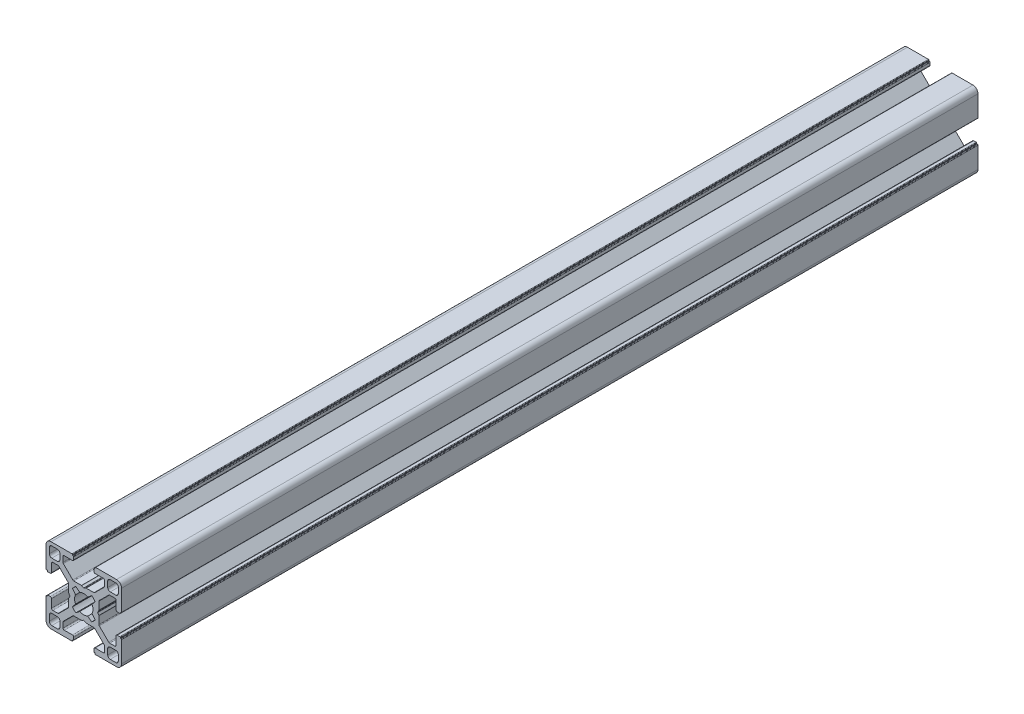
from build123d import *

# Parameters (mm, degrees)
SALIENTE_EXTRUIR1_DEPTH = 1000
CORTAR_EXTRUIR1_START   = -660
CORTAR_EXTRUIR1_DEPTH   = 660


with BuildPart() as part:
    # Croquis1 → Saliente-Extruir1 (new body)
    with BuildSketch(Plane.XY.offset(1000)):
        with BuildLine():
            Line((9.800000436, -10.500000436), (10.100000436, -10.500000436))
            ThreePointArc((10.100000436, -10.500000436), (10.241421792, -10.441421792), (10.300000436, -10.300000436))
            Line((10.300000436, -10.300000436), (10.300000436, -2))
            ThreePointArc((10.300000436, -2), (9.714213998, -0.585786438), (8.300000436, 0))
            Line((8.300000436, 0), (0, 0))
            ThreePointArc((0, 0), (-0.141421356, -0.058578644), (-0.2, -0.2))
            Line((-0.2, -0.2), (-0.2, -0.5))
            Line((-0.2, -0.5), (-0.49999919, -0.5))
            ThreePointArc((-0.49999919, -0.5), (-0.641420811, -0.558578753), (-0.699999564, -0.700000374))
            Line((-0.699999564, -0.700000374), (-0.699999564, -1.700000763))
            ThreePointArc((-0.699999564, -1.700000763), (-0.553552955, -2.053554154), (-0.199999564, -2.200000763))
            Line((-0.199999564, -2.200000763), (3.050000763, -2.200000763))
            ThreePointArc((3.050000763, -2.200000763), (3.403554154, -2.346447372), (3.550000763, -2.700000763))
            Line((3.550000763, -2.700000763), (3.550000763, -4.743055509))
            ThreePointArc((3.550000763, -4.743055509), (3.511993279, -4.934269826), (3.403749103, -5.096413843))
            Line((3.403749103, -5.096413843), (-0.349053376, -8.853358334))
            ThreePointArc((-0.349053376, -8.853358334), (-0.511332616, -8.961886981), (-0.702801716, -9))
            Line((-0.702801716, -9), (-3.746809419, -9))
            ThreePointArc((-3.746809419, -9), (-3.798212795, -9.006718618), (-3.846162576, -9.026423071))
            Line((-3.846162576, -9.026423071), (-4.600646407, -9.458279719))
            ThreePointArc((-4.600646407, -9.458279719), (-4.699999564, -9.48470279), (-4.799352721, -9.458279719))
            Line((-4.799352721, -9.458279719), (-5.553836552, -9.026423071))
            ThreePointArc((-5.553836552, -9.026423071), (-5.601786333, -9.006718618), (-5.653189709, -9))
            Line((-5.653189709, -9), (-8.697197412, -9))
            ThreePointArc((-8.697197412, -9), (-8.888666513, -8.961886981), (-9.050945752, -8.853358334))
            Line((-9.050945752, -8.853358334), (-12.803748231, -5.096413843))
            ThreePointArc((-12.803748231, -5.096413843), (-12.911992407, -4.934269826), (-12.949999891, -4.743055509))
            Line((-12.949999891, -4.743055509), (-12.949999891, -2.700000763))
            ThreePointArc((-12.949999891, -2.700000763), (-12.803553282, -2.346447372), (-12.449999891, -2.200000763))
            Line((-12.449999891, -2.200000763), (-9.199999564, -2.200000763))
            ThreePointArc((-9.199999564, -2.200000763), (-8.846446173, -2.053554154), (-8.699999564, -1.700000763))
            Line((-8.699999564, -1.700000763), (-8.699999564, -0.700000374))
            ThreePointArc((-8.699999564, -0.700000374), (-8.758578317, -0.558578753), (-8.899999938, -0.5))
            Line((-8.899999938, -0.5), (-9.199999128, -0.5))
            Line((-9.199999128, -0.5), (-9.199999128, -0.2))
            ThreePointArc((-9.199999128, -0.2), (-9.258577772, -0.058578644), (-9.399999128, 0))
            Line((-9.399999128, 0), (-17.699999564, 0))
            ThreePointArc((-17.699999564, 0), (-19.114213126, -0.585786438), (-19.699999564, -2))
            Line((-19.699999564, -2), (-19.699999564, -10.300000436))
            ThreePointArc((-19.699999564, -10.300000436), (-19.64142092, -10.441421792), (-19.499999564, -10.500000436))
            Line((-19.499999564, -10.500000436), (-19.199999564, -10.500000436))
            Line((-19.199999564, -10.500000436), (-19.199999564, -10.799999627))
            ThreePointArc((-19.199999564, -10.799999627), (-19.141420811, -10.941421247), (-18.99999919, -11))
            Line((-18.99999919, -11), (-17.999998801, -11))
            ThreePointArc((-17.999998801, -11), (-17.64644541, -10.853553391), (-17.499998801, -10.5))
            Line((-17.499998801, -10.5), (-17.499998801, -7.249999673))
            ThreePointArc((-17.499998801, -7.249999673), (-17.353552192, -6.896446283), (-16.999998801, -6.749999673))
            Line((-16.999998801, -6.749999673), (-14.956944055, -6.749999673))
            ThreePointArc((-14.956944055, -6.749999673), (-14.765729738, -6.788007157), (-14.603585721, -6.896251334))
            Line((-14.603585721, -6.896251334), (-10.84664123, -10.649053813))
            ThreePointArc((-10.84664123, -10.649053813), (-10.738112583, -10.811333052), (-10.699999564, -11.002802152))
            Line((-10.699999564, -11.002802152), (-10.699999564, -14.046809855))
            ThreePointArc((-10.699999564, -14.046809855), (-10.693280947, -14.098213232), (-10.673576493, -14.146163012))
            Line((-10.673576493, -14.146163012), (-10.241719845, -14.900646843))
            ThreePointArc((-10.241719845, -14.900646843), (-10.215296774, -15), (-10.241719845, -15.099353157))
            Line((-10.241719845, -15.099353157), (-10.673576493, -15.853836988))
            ThreePointArc((-10.673576493, -15.853836988), (-10.693280947, -15.901786769), (-10.699999564, -15.953190146))
            Line((-10.699999564, -15.953190146), (-10.699999564, -18.997197848))
            ThreePointArc((-10.699999564, -18.997197848), (-10.738112583, -19.188666949), (-10.84664123, -19.350946188))
            Line((-10.84664123, -19.350946188), (-14.603585721, -23.103748667))
            ThreePointArc((-14.603585721, -23.103748667), (-14.765729738, -23.211992843), (-14.956944055, -23.250000327))
            Line((-14.956944055, -23.250000327), (-16.999998801, -23.250000327))
            ThreePointArc((-16.999998801, -23.250000327), (-17.353552192, -23.103553718), (-17.499998801, -22.750000327))
            Line((-17.499998801, -22.750000327), (-17.499998801, -19.5))
            ThreePointArc((-17.499998801, -19.5), (-17.64644541, -19.14644661), (-17.999998801, -19))
            Line((-17.999998801, -19), (-18.99999919, -19))
            ThreePointArc((-18.99999919, -19), (-19.141420811, -19.058578753), (-19.199999564, -19.200000374))
            Line((-19.199999564, -19.200000374), (-19.199999564, -19.499999564))
            Line((-19.199999564, -19.499999564), (-19.499999564, -19.499999564))
            ThreePointArc((-19.499999564, -19.499999564), (-19.64142092, -19.558578208), (-19.699999564, -19.699999564))
            Line((-19.699999564, -19.699999564), (-19.699999564, -28))
            ThreePointArc((-19.699999564, -28), (-19.114213126, -29.414213563), (-17.699999564, -30))
            Line((-17.699999564, -30), (-9.399999128, -30))
            ThreePointArc((-9.399999128, -30), (-9.258577772, -29.941421356), (-9.199999128, -29.8))
            Line((-9.199999128, -29.8), (-9.199999128, -29.5))
            Line((-9.199999128, -29.5), (-8.899999938, -29.5))
            ThreePointArc((-8.899999938, -29.5), (-8.758578317, -29.441421247), (-8.699999564, -29.299999627))
            Line((-8.699999564, -29.299999627), (-8.699999564, -28.299999237))
            ThreePointArc((-8.699999564, -28.299999237), (-8.846446173, -27.946445847), (-9.199999564, -27.799999237))
            Line((-9.199999564, -27.799999237), (-12.449999891, -27.799999237))
            ThreePointArc((-12.449999891, -27.799999237), (-12.803553282, -27.653552628), (-12.949999891, -27.299999237))
            Line((-12.949999891, -27.299999237), (-12.949999891, -25.256944491))
            ThreePointArc((-12.949999891, -25.256944491), (-12.911992407, -25.065730174), (-12.803748231, -24.903586157))
            Line((-12.803748231, -24.903586157), (-9.050945752, -21.146641666))
            ThreePointArc((-9.050945752, -21.146641666), (-8.888666513, -21.038113019), (-8.697197412, -21))
            Line((-8.697197412, -21), (-5.653189709, -21))
            ThreePointArc((-5.653189709, -21), (-5.601786333, -20.993281383), (-5.553836552, -20.973576929))
            Line((-5.553836552, -20.973576929), (-4.799352721, -20.541720281))
            ThreePointArc((-4.799352721, -20.541720281), (-4.699999564, -20.51529721), (-4.600646407, -20.541720281))
            Line((-4.600646407, -20.541720281), (-3.846162576, -20.973576929))
            ThreePointArc((-3.846162576, -20.973576929), (-3.798212795, -20.993281383), (-3.746809419, -21))
            Line((-3.746809419, -21), (-0.702801716, -21))
            ThreePointArc((-0.702801716, -21), (-0.511332616, -21.038113019), (-0.349053377, -21.146641666))
            Line((-0.349053377, -21.146641666), (3.403749103, -24.903586157))
            ThreePointArc((3.403749103, -24.903586157), (3.511993279, -25.065730174), (3.550000763, -25.256944491))
            Line((3.550000763, -25.256944491), (3.550000763, -27.299999237))
            ThreePointArc((3.550000763, -27.299999237), (3.403554154, -27.653552628), (3.050000763, -27.799999237))
            Line((3.050000763, -27.799999237), (-0.199999564, -27.799999237))
            ThreePointArc((-0.199999564, -27.799999237), (-0.553552955, -27.946445847), (-0.699999564, -28.299999237))
            Line((-0.699999564, -28.299999237), (-0.699999564, -29.299999627))
            ThreePointArc((-0.699999564, -29.299999627), (-0.641420811, -29.441421247), (-0.49999919, -29.5))
            Line((-0.49999919, -29.5), (-0.2, -29.5))
            Line((-0.2, -29.5), (-0.2, -29.8))
            ThreePointArc((-0.2, -29.8), (-0.141421356, -29.941421356), (0, -30))
            Line((0, -30), (8.300000436, -30))
            ThreePointArc((8.300000436, -30), (9.714213998, -29.414213563), (10.300000436, -28))
            Line((10.300000436, -28), (10.300000436, -19.699999564))
            ThreePointArc((10.300000436, -19.699999564), (10.241421792, -19.558578208), (10.100000436, -19.499999564))
            Line((10.100000436, -19.499999564), (9.800000436, -19.499999564))
            Line((9.800000436, -19.499999564), (9.800000436, -19.200000374))
            ThreePointArc((9.800000436, -19.200000374), (9.741421683, -19.058578753), (9.600000062, -19))
            Line((9.600000062, -19), (8.599999673, -19))
            ThreePointArc((8.599999673, -19), (8.246446283, -19.14644661), (8.099999673, -19.5))
            Line((8.099999673, -19.5), (8.099999673, -22.750000327))
            ThreePointArc((8.099999673, -22.750000327), (7.953553064, -23.103553718), (7.599999673, -23.250000327))
            Line((7.599999673, -23.250000327), (5.556944927, -23.250000327))
            ThreePointArc((5.556944927, -23.250000327), (5.36573061, -23.211992843), (5.203586593, -23.103748667))
            Line((5.203586593, -23.103748667), (1.446642102, -19.350946188))
            ThreePointArc((1.446642102, -19.350946188), (1.338113455, -19.188666949), (1.300000436, -18.997197848))
            Line((1.300000436, -18.997197848), (1.300000436, -15.953190145))
            ThreePointArc((1.300000436, -15.953190145), (1.293281819, -15.901786769), (1.273577365, -15.853836988))
            Line((1.273577365, -15.853836988), (0.841720717, -15.099353157))
            ThreePointArc((0.841720717, -15.099353157), (0.815297646, -15), (0.841720717, -14.900646843))
            Line((0.841720717, -14.900646843), (1.273577365, -14.146163012))
            ThreePointArc((1.273577365, -14.146163012), (1.293281819, -14.098213231), (1.300000436, -14.046809855))
            Line((1.300000436, -14.046809855), (1.300000436, -11.002802152))
            ThreePointArc((1.300000436, -11.002802152), (1.338113455, -10.811333051), (1.446642102, -10.649053812))
            Line((1.446642102, -10.649053812), (5.203586593, -6.896251334))
            ThreePointArc((5.203586593, -6.896251334), (5.36573061, -6.788007157), (5.556944927, -6.749999673))
            Line((5.556944927, -6.749999673), (7.599999673, -6.749999673))
            ThreePointArc((7.599999673, -6.749999673), (7.953553064, -6.896446283), (8.099999673, -7.249999673))
            Line((8.099999673, -7.249999673), (8.099999673, -10.5))
            ThreePointArc((8.099999673, -10.5), (8.246446283, -10.853553391), (8.599999673, -11))
            Line((8.599999673, -11), (9.600000062, -11))
            ThreePointArc((9.600000062, -11), (9.741421683, -10.941421247), (9.800000436, -10.799999627))
            Line((9.800000436, -10.799999627), (9.800000436, -10.500000436))
        make_face()
        with BuildLine():
            Line((8.000001536, -5.500000365), (5.800000754, -5.500000365))
            ThreePointArc((5.800000754, -5.500000365), (5.092893979, -5.207107149), (4.800000763, -4.500000374))
            Line((4.800000763, -4.500000374), (4.800000763, -2.299999592))
            ThreePointArc((4.800000763, -2.299999592), (5.092893979, -1.592892818), (5.800000754, -1.299999602))
            Line((5.800000754, -1.299999602), (8.000001536, -1.299999602))
            ThreePointArc((8.000001536, -1.299999602), (8.70710831, -1.592892818), (9.000001526, -2.299999592))
            Line((9.000001526, -2.299999592), (9.000001526, -4.500000374))
            ThreePointArc((9.000001526, -4.500000374), (8.70710831, -5.207107149), (8.000001536, -5.500000365))
        make_face(mode=Mode.SUBTRACT)
        with BuildLine():
            Line((-15.199999881, -5.500000365), (-17.400000663, -5.500000365))
            ThreePointArc((-17.400000663, -5.500000365), (-18.107107438, -5.207107149), (-18.400000654, -4.500000374))
            Line((-18.400000654, -4.500000374), (-18.400000654, -2.299999592))
            ThreePointArc((-18.400000654, -2.299999592), (-18.107107438, -1.592892818), (-17.400000664, -1.299999602))
            Line((-17.400000664, -1.299999602), (-15.199999881, -1.299999602))
            ThreePointArc((-15.199999881, -1.299999602), (-14.492893107, -1.592892818), (-14.199999891, -2.299999592))
            Line((-14.199999891, -2.299999592), (-14.199999891, -4.500000374))
            ThreePointArc((-14.199999891, -4.500000374), (-14.492893107, -5.207107149), (-15.199999881, -5.500000365))
        make_face(mode=Mode.SUBTRACT)
        with BuildLine():
            Line((-17.400000664, -24.499999636), (-15.199999881, -24.499999636))
            ThreePointArc((-15.199999881, -24.499999636), (-14.492893107, -24.792892852), (-14.199999891, -25.499999626))
            Line((-14.199999891, -25.499999626), (-14.199999891, -27.700000408))
            ThreePointArc((-14.199999891, -27.700000408), (-14.492893107, -28.407107183), (-15.199999881, -28.700000399))
            Line((-15.199999881, -28.700000399), (-17.400000663, -28.700000399))
            ThreePointArc((-17.400000663, -28.700000399), (-18.107107438, -28.407107183), (-18.400000654, -27.700000408))
            Line((-18.400000654, -27.700000408), (-18.400000654, -25.499999626))
            ThreePointArc((-18.400000654, -25.499999626), (-18.107107438, -24.792892852), (-17.400000664, -24.499999636))
        make_face(mode=Mode.SUBTRACT)
        with BuildLine():
            Line((5.800000754, -24.499999636), (8.000001536, -24.499999636))
            ThreePointArc((8.000001536, -24.499999636), (8.70710831, -24.792892852), (9.000001526, -25.499999626))
            Line((9.000001526, -25.499999626), (9.000001526, -27.700000408))
            ThreePointArc((9.000001526, -27.700000408), (8.70710831, -28.407107183), (8.000001536, -28.700000399))
            Line((8.000001536, -28.700000399), (5.800000754, -28.700000399))
            ThreePointArc((5.800000754, -28.700000399), (5.092893979, -28.407107183), (4.800000763, -27.700000408))
            Line((4.800000763, -27.700000408), (4.800000763, -25.499999626))
            ThreePointArc((4.800000763, -25.499999626), (5.092893979, -24.792892852), (5.800000754, -24.499999636))
        make_face(mode=Mode.SUBTRACT)
        with BuildLine():
            Line((-7.835928976, -10.481599097), (-6.300129088, -11.719438233))
            ThreePointArc((-6.300129088, -11.719438233), (-4.699999564, -11.35), (-3.09987004, -11.719438233))
            Line((-3.09987004, -11.719438233), (-1.564070152, -10.481599097))
            ThreePointArc((-1.564070152, -10.481599097), (-0.818997305, -11.10284444), (-0.194662672, -11.845330527))
            Line((-0.194662672, -11.845330527), (-1.419437832, -13.399870404))
            ThreePointArc((-1.419437832, -13.399870404), (-1.049999564, -15), (-1.419437832, -16.600129597))
            Line((-1.419437832, -16.600129597), (-0.194662672, -18.154669473))
            ThreePointArc((-0.194662672, -18.154669473), (-0.818997305, -18.897155561), (-1.564070152, -19.518400903))
            Line((-1.564070152, -19.518400903), (-3.09987004, -18.280561767))
            ThreePointArc((-3.09987004, -18.280561767), (-4.699999564, -18.65), (-6.300129088, -18.280561767))
            Line((-6.300129088, -18.280561767), (-7.835928976, -19.518400903))
            ThreePointArc((-7.835928976, -19.518400903), (-8.581001823, -18.897155561), (-9.205336456, -18.154669473))
            Line((-9.205336456, -18.154669473), (-7.980561295, -16.600129597))
            ThreePointArc((-7.980561295, -16.600129597), (-8.349999564, -15), (-7.980561296, -13.399870404))
            Line((-7.980561296, -13.399870404), (-9.205336456, -11.845330527))
            ThreePointArc((-9.205336456, -11.845330527), (-8.581001823, -11.10284444), (-7.835928976, -10.481599097))
        make_face(mode=Mode.SUBTRACT)
    extrude(amount=-SALIENTE_EXTRUIR1_DEPTH)

    # Croquis4 → Cortar-Extruir1 (cut)
    with BuildSketch(Plane(origin=(0, 0, 0), x_dir=(-1, 0, 0), z_dir=(0, 0, -1)).offset(CORTAR_EXTRUIR1_START)):
        with BuildLine():
            Line((-9.800000436, -10.500000436), (-9.800000436, -10.799999627))
            ThreePointArc((-9.800000436, -10.799999627), (-9.741421683, -10.941421247), (-9.600000062, -11))
            Line((-9.600000062, -11), (-8.599999673, -11))
            ThreePointArc((-8.599999673, -11), (-8.246446283, -10.853553391), (-8.099999673, -10.5))
            Line((-8.099999673, -10.5), (-8.099999673, -7.249999673))
            ThreePointArc((-8.099999673, -7.249999673), (-7.953553064, -6.896446283), (-7.599999673, -6.749999673))
            Line((-7.599999673, -6.749999673), (-5.556944927, -6.749999673))
            ThreePointArc((-5.556944927, -6.749999673), (-5.36573061, -6.788007157), (-5.203586593, -6.896251334))
            Line((-5.203586593, -6.896251334), (-1.446642102, -10.649053812))
            ThreePointArc((-1.446642102, -10.649053812), (-1.338113455, -10.811333051), (-1.300000436, -11.002802152))
            Line((-1.300000436, -11.002802152), (-1.300000436, -14.046809855))
            ThreePointArc((-1.300000436, -14.046809855), (-1.293281819, -14.098213231), (-1.273577365, -14.146163012))
            Line((-1.273577365, -14.146163012), (-0.841720717, -14.900646843))
            ThreePointArc((-0.841720717, -14.900646843), (-0.815297646, -15), (-0.841720717, -15.099353157))
            Line((-0.841720717, -15.099353157), (-1.273577365, -15.853836988))
            ThreePointArc((-1.273577365, -15.853836988), (-1.293281819, -15.901786769), (-1.300000436, -15.953190145))
            Line((-1.300000436, -15.953190145), (-1.300000436, -18.997197848))
            ThreePointArc((-1.300000436, -18.997197848), (-1.338113455, -19.188666949), (-1.446642102, -19.350946188))
            Line((-1.446642102, -19.350946188), (-5.203586593, -23.103748667))
            ThreePointArc((-5.203586593, -23.103748667), (-5.36573061, -23.211992843), (-5.556944927, -23.250000327))
            Line((-5.556944927, -23.250000327), (-7.599999673, -23.250000327))
            ThreePointArc((-7.599999673, -23.250000327), (-7.953553064, -23.103553718), (-8.099999673, -22.750000327))
            Line((-8.099999673, -22.750000327), (-8.099999673, -19.5))
            ThreePointArc((-8.099999673, -19.5), (-8.246446283, -19.14644661), (-8.599999673, -19))
            Line((-8.599999673, -19), (-9.600000062, -19))
            ThreePointArc((-9.600000062, -19), (-9.741421683, -19.058578753), (-9.800000436, -19.200000374))
            Line((-9.800000436, -19.200000374), (-9.800000436, -19.499999564))
            Line((-9.800000436, -19.499999564), (-10.100000436, -19.499999564))
            ThreePointArc((-10.100000436, -19.499999564), (-10.241421792, -19.558578208), (-10.300000436, -19.699999564))
            Line((-10.300000436, -19.699999564), (-10.300000436, -28))
            ThreePointArc((-10.300000436, -28), (-9.714213998, -29.414213563), (-8.300000436, -30))
            Line((-8.300000436, -30), (0, -30))
            ThreePointArc((0, -30), (0.141421356, -29.941421356), (0.2, -29.8))
            Line((0.2, -29.8), (0.2, -29.5))
            Line((0.2, -29.5), (0.49999919, -29.5))
            ThreePointArc((0.49999919, -29.5), (0.641420811, -29.441421247), (0.699999564, -29.299999627))
            Line((0.699999564, -29.299999627), (0.699999564, -28.299999237))
            ThreePointArc((0.699999564, -28.299999237), (0.553552955, -27.946445847), (0.199999564, -27.799999237))
            Line((0.199999564, -27.799999237), (-3.050000763, -27.799999237))
            ThreePointArc((-3.050000763, -27.799999237), (-3.403554154, -27.653552628), (-3.550000763, -27.299999237))
            Line((-3.550000763, -27.299999237), (-3.550000763, -25.256944491))
            ThreePointArc((-3.550000763, -25.256944491), (-3.511993279, -25.065730174), (-3.403749103, -24.903586157))
            Line((-3.403749103, -24.903586157), (0.349053377, -21.146641666))
            ThreePointArc((0.349053377, -21.146641666), (0.511332616, -21.038113019), (0.702801716, -21))
            Line((0.702801716, -21), (3.746809419, -21))
            ThreePointArc((3.746809419, -21), (3.798212795, -20.993281383), (3.846162576, -20.973576929))
            Line((3.846162576, -20.973576929), (4.600646407, -20.541720281))
            ThreePointArc((4.600646407, -20.541720281), (4.699999564, -20.51529721), (4.799352721, -20.541720281))
            Line((4.799352721, -20.541720281), (5.553836552, -20.973576929))
            ThreePointArc((5.553836552, -20.973576929), (5.601786333, -20.993281383), (5.653189709, -21))
            Line((5.653189709, -21), (8.697197412, -21))
            ThreePointArc((8.697197412, -21), (8.888666513, -21.038113019), (9.050945752, -21.146641666))
            Line((9.050945752, -21.146641666), (12.803748231, -24.903586157))
            ThreePointArc((12.803748231, -24.903586157), (12.911992407, -25.065730174), (12.949999891, -25.256944491))
            Line((12.949999891, -25.256944491), (12.949999891, -27.299999237))
            ThreePointArc((12.949999891, -27.299999237), (12.803553282, -27.653552628), (12.449999891, -27.799999237))
            Line((12.449999891, -27.799999237), (9.199999564, -27.799999237))
            ThreePointArc((9.199999564, -27.799999237), (8.846446173, -27.946445847), (8.699999564, -28.299999237))
            Line((8.699999564, -28.299999237), (8.699999564, -29.299999627))
            ThreePointArc((8.699999564, -29.299999627), (8.758578317, -29.441421247), (8.899999938, -29.5))
            Line((8.899999938, -29.5), (9.199999128, -29.5))
            Line((9.199999128, -29.5), (9.199999128, -29.8))
            ThreePointArc((9.199999128, -29.8), (9.258577772, -29.941421356), (9.399999128, -30))
            Line((9.399999128, -30), (17.699999564, -30))
            ThreePointArc((17.699999564, -30), (19.114213126, -29.414213563), (19.699999564, -28))
            Line((19.699999564, -28), (19.699999564, -19.699999564))
            ThreePointArc((19.699999564, -19.699999564), (19.64142092, -19.558578208), (19.499999564, -19.499999564))
            Line((19.499999564, -19.499999564), (19.199999564, -19.499999564))
            Line((19.199999564, -19.499999564), (19.199999564, -19.200000374))
            ThreePointArc((19.199999564, -19.200000374), (19.141420811, -19.058578753), (18.99999919, -19))
            Line((18.99999919, -19), (17.999998801, -19))
            ThreePointArc((17.999998801, -19), (17.64644541, -19.14644661), (17.499998801, -19.5))
            Line((17.499998801, -19.5), (17.499998801, -22.750000327))
            ThreePointArc((17.499998801, -22.750000327), (17.353552192, -23.103553718), (16.999998801, -23.250000327))
            Line((16.999998801, -23.250000327), (14.956944055, -23.250000327))
            ThreePointArc((14.956944055, -23.250000327), (14.765729738, -23.211992843), (14.603585721, -23.103748667))
            Line((14.603585721, -23.103748667), (10.84664123, -19.350946188))
            ThreePointArc((10.84664123, -19.350946188), (10.738112583, -19.188666949), (10.699999564, -18.997197848))
            Line((10.699999564, -18.997197848), (10.699999564, -15.953190146))
            ThreePointArc((10.699999564, -15.953190146), (10.693280947, -15.901786769), (10.673576493, -15.853836988))
            Line((10.673576493, -15.853836988), (10.241719845, -15.099353157))
            ThreePointArc((10.241719845, -15.099353157), (10.215296774, -15), (10.241719845, -14.900646843))
            Line((10.241719845, -14.900646843), (10.673576493, -14.146163012))
            ThreePointArc((10.673576493, -14.146163012), (10.693280947, -14.098213232), (10.699999564, -14.046809855))
            Line((10.699999564, -14.046809855), (10.699999564, -11.002802152))
            ThreePointArc((10.699999564, -11.002802152), (10.738112583, -10.811333052), (10.84664123, -10.649053813))
            Line((10.84664123, -10.649053813), (14.603585721, -6.896251334))
            ThreePointArc((14.603585721, -6.896251334), (14.765729738, -6.788007157), (14.956944055, -6.749999673))
            Line((14.956944055, -6.749999673), (16.999998801, -6.749999673))
            ThreePointArc((16.999998801, -6.749999673), (17.353552192, -6.896446283), (17.499998801, -7.249999673))
            Line((17.499998801, -7.249999673), (17.499998801, -10.5))
            ThreePointArc((17.499998801, -10.5), (17.64644541, -10.853553391), (17.999998801, -11))
            Line((17.999998801, -11), (18.99999919, -11))
            ThreePointArc((18.99999919, -11), (19.141420811, -10.941421247), (19.199999564, -10.799999627))
            Line((19.199999564, -10.799999627), (19.199999564, -10.500000436))
            Line((19.199999564, -10.500000436), (19.499999564, -10.500000436))
            ThreePointArc((19.499999564, -10.500000436), (19.64142092, -10.441421792), (19.699999564, -10.300000436))
            Line((19.699999564, -10.300000436), (19.699999564, -2))
            ThreePointArc((19.699999564, -2), (19.114213126, -0.585786438), (17.699999564, 0))
            Line((17.699999564, 0), (9.399999128, 0))
            ThreePointArc((9.399999128, 0), (9.258577772, -0.058578644), (9.199999128, -0.2))
            Line((9.199999128, -0.2), (9.199999128, -0.5))
            Line((9.199999128, -0.5), (8.899999938, -0.5))
            ThreePointArc((8.899999938, -0.5), (8.758578317, -0.558578753), (8.699999564, -0.700000374))
            Line((8.699999564, -0.700000374), (8.699999564, -1.700000763))
            ThreePointArc((8.699999564, -1.700000763), (8.846446173, -2.053554154), (9.199999564, -2.200000763))
            Line((9.199999564, -2.200000763), (12.449999891, -2.200000763))
            ThreePointArc((12.449999891, -2.200000763), (12.803553282, -2.346447372), (12.949999891, -2.700000763))
            Line((12.949999891, -2.700000763), (12.949999891, -4.743055509))
            ThreePointArc((12.949999891, -4.743055509), (12.911992407, -4.934269826), (12.803748231, -5.096413843))
            Line((12.803748231, -5.096413843), (9.050945752, -8.853358334))
            ThreePointArc((9.050945752, -8.853358334), (8.888666513, -8.961886981), (8.697197412, -9))
            Line((8.697197412, -9), (5.653189709, -9))
            ThreePointArc((5.653189709, -9), (5.601786333, -9.006718618), (5.553836552, -9.026423071))
            Line((5.553836552, -9.026423071), (4.799352721, -9.458279719))
            ThreePointArc((4.799352721, -9.458279719), (4.699999564, -9.48470279), (4.600646407, -9.458279719))
            Line((4.600646407, -9.458279719), (3.846162576, -9.026423071))
            ThreePointArc((3.846162576, -9.026423071), (3.798212795, -9.006718618), (3.746809419, -9))
            Line((3.746809419, -9), (0.702801716, -9))
            ThreePointArc((0.702801716, -9), (0.511332616, -8.961886981), (0.349053376, -8.853358334))
            Line((0.349053376, -8.853358334), (-3.403749103, -5.096413843))
            ThreePointArc((-3.403749103, -5.096413843), (-3.511993279, -4.934269826), (-3.550000763, -4.743055509))
            Line((-3.550000763, -4.743055509), (-3.550000763, -2.700000763))
            ThreePointArc((-3.550000763, -2.700000763), (-3.403554154, -2.346447372), (-3.050000763, -2.200000763))
            Line((-3.050000763, -2.200000763), (0.199999564, -2.200000763))
            ThreePointArc((0.199999564, -2.200000763), (0.553552955, -2.053554154), (0.699999564, -1.700000763))
            Line((0.699999564, -1.700000763), (0.699999564, -0.700000374))
            ThreePointArc((0.699999564, -0.700000374), (0.641420811, -0.558578753), (0.49999919, -0.5))
            Line((0.49999919, -0.5), (0.2, -0.5))
            Line((0.2, -0.5), (0.2, -0.2))
            ThreePointArc((0.2, -0.2), (0.141421356, -0.058578644), (0, 0))
            Line((0, 0), (-8.300000436, 0))
            ThreePointArc((-8.300000436, 0), (-9.714213998, -0.585786438), (-10.300000436, -2))
            Line((-10.300000436, -2), (-10.300000436, -10.300000436))
            ThreePointArc((-10.300000436, -10.300000436), (-10.241421792, -10.441421792), (-10.100000436, -10.500000436))
            Line((-10.100000436, -10.500000436), (-9.800000436, -10.500000436))
        make_face()
    extrude(amount=CORTAR_EXTRUIR1_DEPTH, mode=Mode.SUBTRACT)


solid = part.part
